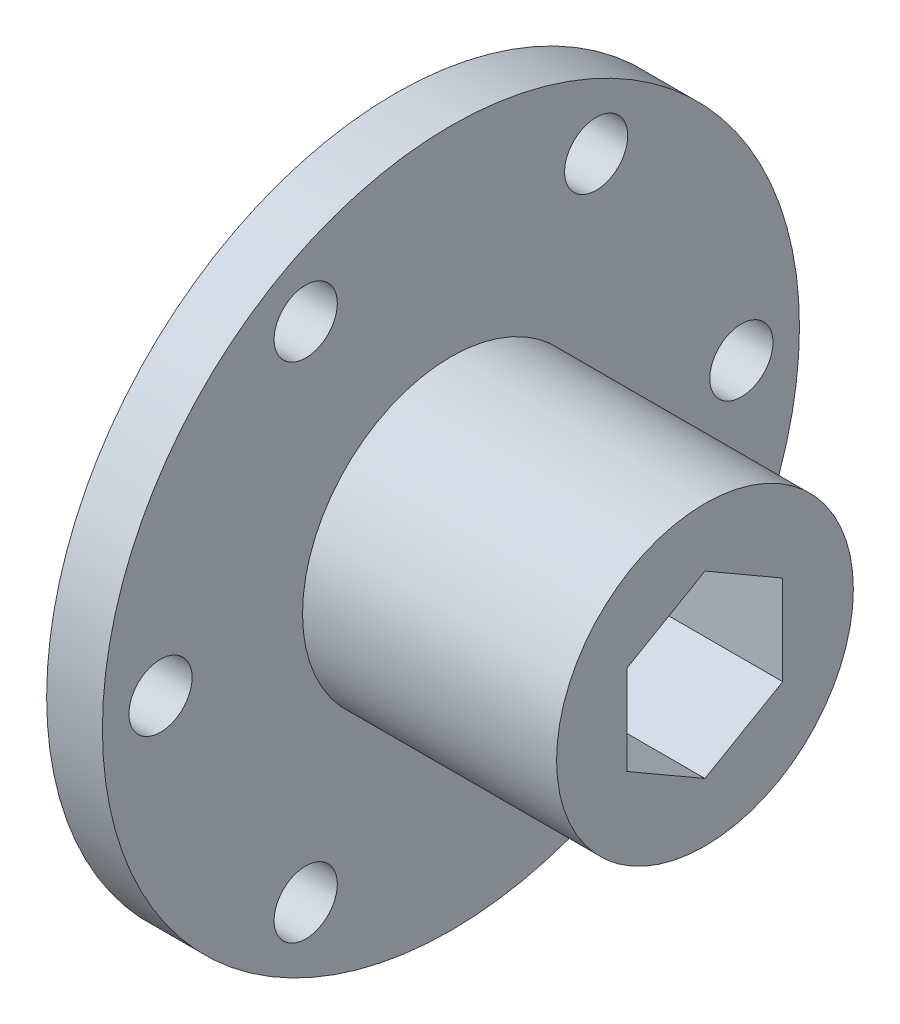
from build123d import *

# Parameters (mm, degrees)
SKETCH1_W           = 4.572
SKETCH1_H           = 28.575
SKETCH2_R           = 12.1666
BOSS_EXTRUDE1_DEPTH = 20.828
CUT_EXTRUDE1_DEPTH  = 48.730716001
HOLE1_D             = 5.1816
CIRPATTERN1_COUNT   = 6


with BuildPart() as part:
    # Sketch1 → Revolve1 (revolve)
    with BuildSketch(Plane(origin=(0, 0, 0), x_dir=(-1, 0, 0), z_dir=(0, 0, -1))):
        with Locations((15.321066246, 14.2875)):
            Rectangle(SKETCH1_W, SKETCH1_H)
    revolve(axis=Axis((-13.035066246, 0, 0), (-1, 0, 0)))

    # Sketch2 → Boss-Extrude1 (add)
    with BuildSketch(Plane(origin=(-13.035066246, 0, 0), x_dir=(0, 0, -1), z_dir=(1, 0, 0))):
        Circle(SKETCH2_R)
    extrude(amount=BOSS_EXTRUDE1_DEPTH)

    # Sketch3 → Cut-Extrude1 (cut, through all)
    with BuildSketch(Plane(origin=(7.792933754, 0, 0), x_dir=(0, 0, -1), z_dir=(1, 0, 0))):
        Polygon((0, -7.361697812), (6.3754, -3.680858906), (6.3754, 3.680818906), (0, 7.361657812), (-6.3754, 3.680818906), (-6.3754, -3.680858906), align=None)
    extrude(amount=-CUT_EXTRUDE1_DEPTH, mode=Mode.SUBTRACT)

    # Hole1 (through all)
    with Locations(Plane(origin=(-13.035066246, 0, 0), x_dir=(0, 0, -1), z_dir=(1, 0, 0))):
        with Locations((-23.8125, 0)):
            hole1 = Hole(HOLE1_D / 2)

    # CirPattern1: Hole1 ×6 about axis
    cirpattern1_axis = Axis((84.678933754, 0, 0), (-1, 0, 0))
    for i in range(1, CIRPATTERN1_COUNT):
        add(hole1.rotate(cirpattern1_axis, i * 360 / CIRPATTERN1_COUNT), mode=Mode.SUBTRACT)


solid = part.part
